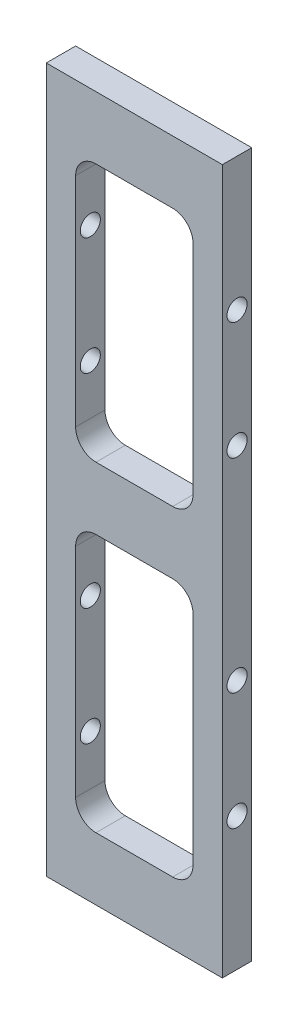
from build123d import *

# Parameters (mm, degrees)
SKETCH1_W             = 28.575
SKETCH1_H             = 114.3
BOSS_EXTRUDE1_DEPTH   = 4.7625
SKETCH2_W             = 19.05
SKETCH2_H             = 41.91
CUT_EXTRUDE1_DEPTH    = 60.101070739
FILLET1_R             = 3.302
F_4_CLEARANCE_HOLE1_D = 3.2639


with BuildPart() as part:
    # Sketch1 → Boss-Extrude1 (new body)
    with BuildSketch(Plane.XY):
        Rectangle(SKETCH1_W, SKETCH1_H)
    extrude(amount=BOSS_EXTRUDE1_DEPTH)

    # Sketch2 → Cut-Extrude1 (cut, through all)
    with BuildSketch(Plane.XY.offset(4.7625)):
        with Locations((0, 26.035)):
            Rectangle(SKETCH2_W, SKETCH2_H)
        with Locations((0, -26.035)):
            Rectangle(SKETCH2_W, SKETCH2_H)
    extrude(amount=-CUT_EXTRUDE1_DEPTH, mode=Mode.SUBTRACT)

    # Fillet1
    fillet1_edges = [part.edges().sort_by_distance(p)[0] for p in [
        (9.525, 46.99, 2.38125),
        (9.525, 5.08, 2.38125),
        (-9.525, 5.08, 2.38125),
        (-9.525, 46.99, 2.38125),
        (-9.525, -46.99, 2.38125),
        (-9.525, -5.08, 2.38125),
        (9.525, -5.08, 2.38125),
        (9.525, -46.99, 2.38125),
    ]]
    fillet(fillet1_edges, radius=FILLET1_R)

    # #4 Clearance Hole1 (through all)
    with Locations(Plane(origin=(14.2875, 0, 0), x_dir=(0, 0, -1), z_dir=(1, 0, 0))):
        with Locations((-2.38125, 35.56), (-2.38125, 16.51), (-2.38125, -16.51), (-2.38125, -35.56)):
            Hole(F_4_CLEARANCE_HOLE1_D / 2)


solid = part.part
